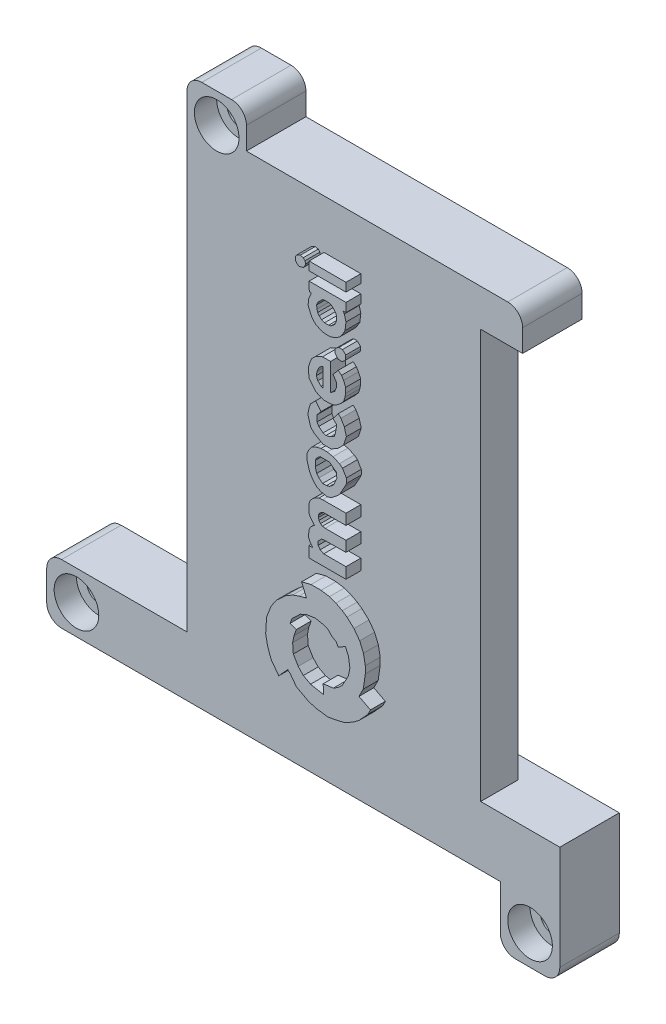
from build123d import *

# Parameters (mm, degrees)
EXTRUDE_1_DEPTH     = 8
SKETCH_2_R          = 1.6
CUT_EXTRUDE_1_DEPTH = 52.886896226
FILLET_1_R          = 2
SKETCH_3_R          = 3
CUT_EXTRUDE_2_DEPTH = 3
SKETCH_4_W          = 1.5
SKETCH_4_H          = 60
EXTRUDE_2_DEPTH     = 8
SKETCH_5_W          = 8
SKETCH_5_H          = 8
CUT_EXTRUDE_3_DEPTH = 52.886896226
SKETCH_8_W          = 5.14
SKETCH_8_H          = 8
EXTRUDE_4_DEPTH     = 8
SKETCH_9_W          = 8
SKETCH_9_H          = 8
SKETCH_9_R          = 1.6
EXTRUDE_5_DEPTH     = 8
SKETCH_10_R         = 3
CUT_EXTRUDE_5_DEPTH = 3
FILLET_3_R          = 2
SKETCH_11_W         = 3
SKETCH_11_H         = 52
CUT_EXTRUDE_6_DEPTH = 74.935782947
SKETCH_13_W         = 5.64
SKETCH_13_H         = 5
EXTRUDE_6_DEPTH     = 8
FILLET_4_R          = 2
SKETCH_14_W         = 4.955155642
SKETCH_14_H         = 1.145782211
EXTRUDE_7_DEPTH     = 2
SKETCH_16_W         = 26.241789117
SKETCH_16_H         = 17.675823019
CUT_EXTRUDE_7_DEPTH = 58.794895968
SKETCH_17_W         = 18.86
SKETCH_17_H         = 8
SKETCH_17_R         = 1.6
EXTRUDE_8_DEPTH     = 8
SKETCH_18_R         = 3
CUT_EXTRUDE_8_DEPTH = 3
FILLET_5_R          = 2


with BuildPart() as part:
    # 草图1 → 凸台-拉伸1 (new body)
    with BuildSketch(Plane.XY):
        Polygon((-17, 36.5), (-17, 23.5), (-17, -28.5), (-36, -28.5), (-36, -36.5), (36, -36.5), (36, -28.5), (23.511470082, -28.5), (21, -28.5), (21, 31.5), (-9, 31.5), (-9, 36.5), align=None)
    extrude(amount=EXTRUDE_1_DEPTH)

    # 草图2 → 切除-拉伸1 (cut, through all)
    with BuildSketch(Plane.XY.offset(8)):
        with Locations((-13, 32.5)):
            Circle(SKETCH_2_R)
        with Locations((-32, -32.5)):
            Circle(SKETCH_2_R)
        with Locations((32, -32.5)):
            Circle(SKETCH_2_R)
    extrude(amount=-CUT_EXTRUDE_1_DEPTH, mode=Mode.SUBTRACT)

    # 圆角1
    fillet_1_edges = [part.edges().sort_by_distance(p)[0] for p in [
        (-9, 36.5, 4),
        (36, -28.5, 4),
        (36, -36.5, 4),
        (-36, -36.5, 4),
        (-36, -28.5, 4),
        (-17, 36.5, 4),
    ]]
    fillet(fillet_1_edges, radius=FILLET_1_R)

    # 草图3 → 切除-拉伸2 (cut)
    with BuildSketch(Plane.XY.offset(8)):
        with Locations((-13, 32.5)):
            Circle(SKETCH_3_R)
        with Locations((-32, -32.5)):
            Circle(SKETCH_3_R)
        with Locations((32, -32.5)):
            Circle(SKETCH_3_R)
    extrude(amount=-CUT_EXTRUDE_2_DEPTH, mode=Mode.SUBTRACT)

    # 草图4 → 凸台-拉伸2 (add)
    with BuildSketch(Plane.XY.offset(8)):
        with Locations((21.75, 1.5)):
            Rectangle(SKETCH_4_W, SKETCH_4_H)
    extrude(amount=-EXTRUDE_2_DEPTH)

    # 草图5 → 切除-拉伸3 (cut, through all)
    with BuildSketch(Plane.XY.offset(8)):
        with Locations((32, -32.5)):
            Rectangle(SKETCH_5_W, SKETCH_5_H)
    extrude(amount=-CUT_EXTRUDE_3_DEPTH, mode=Mode.SUBTRACT)

    # 草图8 → 凸台-拉伸4 (add)
    with BuildSketch(Plane.XY.offset(8)):
        with Locations((30.57, -32.5)):
            Rectangle(SKETCH_8_W, SKETCH_8_H)
    extrude(amount=-EXTRUDE_4_DEPTH)

    # 草图9 → 凸台-拉伸5 (add)
    with BuildSketch(Plane.XY.offset(8)):
        with Locations((29.14, -40.5)):
            Rectangle(SKETCH_9_W, SKETCH_9_H)
        with Locations((29.14, -40.5)):
            Circle(SKETCH_9_R, mode=Mode.SUBTRACT)
    extrude(amount=-EXTRUDE_5_DEPTH)

    # 草图10 → 切除-拉伸5 (cut)
    with BuildSketch(Plane.XY.offset(8)):
        with Locations((29.14, -40.5)):
            Circle(SKETCH_10_R)
    extrude(amount=-CUT_EXTRUDE_5_DEPTH, mode=Mode.SUBTRACT)

    # 圆角3
    fillet_3_edges = [part.edges().sort_by_distance(p)[0] for p in [
        (25.14, -44.5, 4),
        (33.14, -44.5, 4),
    ]]
    fillet(fillet_3_edges, radius=FILLET_3_R)

    # 草图11 → 切除-拉伸6 (cut, through all)
    with BuildSketch(Plane(origin=(22.5, 0, 0), x_dir=(0, 0, -1), z_dir=(1, 0, 0))):
        with Locations((-1.5, -2.5)):
            Rectangle(SKETCH_11_W, SKETCH_11_H)
    extrude(amount=-CUT_EXTRUDE_6_DEPTH, mode=Mode.SUBTRACT)

    # 草图13 → 凸台-拉伸6 (add)
    with BuildSketch(Plane.XY.offset(8)):
        with Locations((25.32, 29)):
            Rectangle(SKETCH_13_W, SKETCH_13_H)
    extrude(amount=-EXTRUDE_6_DEPTH)

    # 圆角4
    fillet_4_edges = [part.edges().sort_by_distance(p)[0] for p in [
        (28.14, 31.5, 4),
    ]]
    fillet(fillet_4_edges, radius=FILLET_4_R)

    # 草图14 → 凸台-拉伸7 (add)
    # profile 1 of 9: a face of its own
    with BuildSketch(Plane.XY.offset(8)):
        Polygon((1.402065016, -9.679325293), (6.381663226, -9.679325293), (6.381663226, -8.211654242), (3.3939043, -8.211654242), (2.92215289, -7.9670424), (2.6425965, -7.600124637), (2.6425965, -7.093428679), (2.887191339, -6.84883384), (3.094574912, -6.641450266), (3.341420542, -6.573802125), (6.381663226, -6.54645484), (6.381663226, -5.138069694), (3.58298822, -5.138069694), (3.217997727, -5.083375125), (2.954000679, -4.910175657), (2.764893919, -4.632144932), (2.681682685, -4.328510139), (2.681682685, -4.085199244), (2.812706376, -3.788936997), (3.033783665, -3.567859708), (3.313009633, -3.415314641), (3.755940298, -3.415314641), (6.381663226, -3.415314641), (6.381663226, -1.982352914), (3.249028314, -1.982352914), (2.747194531, -2.037528592), (2.255866113, -2.254552925), (1.957224854, -2.491300898), (1.694085702, -2.75444005), (1.522836734, -3.015464074), (1.402065016, -3.384406137), (1.402065016, -4.431723867), (1.572952789, -4.818602233), (1.804531171, -5.110722409), (2.037845875, -5.405032835), (2.12941328, -5.52053881), (1.804531171, -5.778089227), (1.572952789, -6.077808365), (1.435759026, -6.388021979), (1.36670543, -6.84883384), (1.36670543, -7.329589901), (1.478092254, -7.581762141), (1.622033042, -7.845238416), (1.804531171, -8.075447234), (1.966972226, -8.237888288), (1.422398842, -8.237888288), align=None)
    # profile 2 of 9: a face of its own
    with BuildSketch(Plane.XY.offset(8)):
        Polygon((1.17487881, 1.827946024), (1.17487881, 2.391717474), (1.402065016, 2.905416144), (1.825655278, 3.453645678), (2.448301575, 3.728674339), (3.033783665, 3.889125935), (3.852649284, 3.889125935), (4.645351253, 3.728674339), (5.086706401, 3.533482474), (5.501489329, 3.350042327), (5.92143789, 3.025568525), (6.190678633, 2.576396696), (6.440905615, 2.158945346), (6.440905615, 1.496946701), (6.26067092, 1.089411733), (5.781443798, 0.23732149), (5.537099721, -0.197134731), (5.159491903, -0.574742549), (4.408087428, -1.170418736), (3.852649284, -1.322636777), (3.060170459, -1.162230348), (2.501530322, -0.915168519), (1.957224854, -0.370863051), (1.522836734, 0.353822615), (1.288471913, 1.089411733), (1.138555945, 1.636449697), align=None)
        Polygon((2.747194531, 2.761075917), (2.377836088, 2.391717474), (2.255866113, 2.115926899), (2.255866113, 1.383152458), (2.448301575, 0.680962392), (2.747194531, 0.303929518), (3.249028314, -0.083813007), (3.755940298, -0.083813007), (4.170823602, 0.029885925), (4.694154951, 0.444757054), (4.953891934, 1.032057425), (5.159491903, 1.496946701), (5.086706401, 2.158945346), (4.645351253, 2.499958975), (4.170823602, 2.866603382), (3.534474966, 2.866603382), (2.923245021, 2.866603382), align=None, mode=Mode.SUBTRACT)
    # profile 3 of 9: a face of its own
    with BuildSketch(Plane.XY.offset(8)):
        Polygon((3.033783665, 8.175824675), (2.3168511, 9.080185717), (1.613860147, 8.377194763), (1.402065016, 7.730187882), (1.262459559, 6.994179536), (1.469379975, 6.239134397), (1.658640461, 5.645111993), (2.136978427, 5.166774027), (3.313009633, 4.505358109), (4.408087428, 4.505358109), (5.348295812, 5.068933977), (6.056058262, 5.776696427), (6.268562751, 6.425870305), (6.440905615, 6.952355586), (6.162310506, 7.968939097), (5.702177037, 8.736575489), (5.348295812, 9.090456714), (4.641604177, 8.175824675), (5.087240971, 7.730187882), (5.087240971, 7.324525309), (4.952973087, 6.616656967), (4.811388458, 6.18413414), (4.314996986, 5.886589192), (3.683836391, 5.713619384), (3.313009633, 5.835008049), (2.72499403, 6.28933907), (2.483240902, 6.692653568), (2.483240902, 7.527356595), align=None)
    # profile 4 of 9: a face of its own
    with BuildSketch(Plane.XY.offset(8)):
        Polygon((4.641604177, 13.309933667), (5.348295812, 14.142324896), (5.781443798, 13.774586689), (6.056058262, 13.316449931), (6.348328701, 12.654769414), (6.348328701, 11.984831779), (6.248972889, 11.461021976), (6.056058262, 10.871692604), (5.702177037, 10.454866349), (4.994949995, 9.894211839), (4.314996986, 9.707870451), (3.313009633, 9.707870451), (2.3168511, 10.148427319), (1.850607691, 10.736561261), (1.426507584, 11.271534331), (1.348081875, 11.984831779), (1.348081875, 12.568272163), (1.552333513, 13.192234644), (1.788451502, 13.726129282), (2.3168511, 14.25452888), (2.675317383, 14.412866772), (3.228859993, 14.657371692), (3.860548531, 14.657371692), (4.314996986, 14.657371692), (4.314996986, 11.004047796), (4.864422574, 11.439605143), (5.087240971, 11.943427607), (5.087240971, 12.654769414), align=None)
        Polygon((3.313009633, 13.54551831), (3.313009633, 11.004047796), (3.033783665, 11.127537095), (2.604117466, 11.557203294), (2.39216164, 12.037056956), (2.498139553, 12.595778875), (2.736685409, 13.135163248), (3.033783665, 13.432261504), align=None, mode=Mode.SUBTRACT)
    # profile 5 of 9: a face of its own
    with BuildSketch(Plane.XY.offset(8)):
        Polygon((5.65927176, 16.851418456), (5.91875103, 16.851418456), (6.087418243, 16.682751242), (6.348328701, 16.421840784), (6.348328701, 16.091106805), (6.290640818, 15.78697282), (6.087418243, 15.583750246), (5.836028894, 15.412757486), (5.348295812, 15.419637759), (5.123099152, 15.644834419), (4.922983307, 15.939039812), (4.922983307, 16.421840784), (5.167315538, 16.666173015), (5.439658829, 16.851418456), align=None)
    # profile 6 of 9: a face of its own
    with BuildSketch(Plane.XY.offset(8)):
        Polygon((1.426507584, 22.566743875), (6.381663226, 22.566743875), (6.381663226, 21.376024691), (6.000604884, 21.376024691), (6.162310506, 21.105961801), (6.248972889, 20.778816281), (6.381663226, 20.27791788), (6.315318058, 19.716273962), (6.255621711, 19.210915537), (6.000604884, 18.743432822), (5.59903531, 18.184397655), (5.167315538, 17.856267351), (4.783789665, 17.695259239), (4.346998253, 17.511889706), (3.58298822, 17.511889706), (3.112082847, 17.603574472), (2.3168511, 17.971273144), (1.788451502, 18.523300955), (1.593379114, 18.987968898), (1.299149537, 19.688832066), (1.348081875, 20.449648001), (1.552333513, 20.924497818), (1.734741569, 21.348565076), (1.450207694, 21.348565076), align=None)
        Polygon((2.675317383, 20.778816281), (3.054241856, 21.157740754), (3.294953592, 21.348565076), (3.544704262, 21.376024691), (3.927400997, 21.376024691), (4.22539543, 21.376024691), (4.536115916, 21.172171567), (4.783789665, 20.924497818), (4.994949995, 20.658133609), (5.102577159, 20.39278709), (5.138567236, 20.065450166), (5.086242471, 19.716273962), (4.88936983, 19.271118353), (4.606220376, 18.987968898), (4.380755673, 18.834609849), (4.048053989, 18.743432822), (3.498423012, 18.751186266), (3.112082847, 18.922047437), (2.771833633, 19.210915537), (2.579488816, 19.493696157), (2.483240902, 19.844901325), (2.434059322, 20.292217597), (2.56251531, 20.582673921), align=None, mode=Mode.SUBTRACT)
    # profile 7 of 9: a face of its own
    with BuildSketch(Plane.XY.offset(8)):
        Polygon((0.239057895, 24.990082687), (0.65101973, 24.909874163), (0.87778222, 24.672971635), (0.967593759, 24.333938235), (0.829140592, 24.012058512), (0.65101973, 23.764091952), (0.415805615, 23.701782629), (0.068553901, 23.609794021), (-0.146248154, 23.764091952), (-0.434228892, 24.064950197), (-0.434228892, 24.503454935), (-0.227373976, 24.791422899), (0.003836638, 24.888487496), align=None)
    # profile 8 of 9: a face of its own
    with BuildSketch(Plane.XY.offset(8)):
        with Locations((3.904085405, 24.336983057)):
            Rectangle(SKETCH_14_W, SKETCH_14_H)
    # profile 9 of 9: a face of its own
    with BuildSketch(Plane.XY.offset(8)):
        Polygon((1.073540166, -14.519810043), (0.415805615, -12.959668722), (1.694085702, -12.635483512), (3.033783665, -12.635483512), (4.170823602, -12.797576117), (5.021225382, -13.131892114), (5.887867903, -13.577646778), (6.513773217, -14.013270653), (7.455936482, -14.874387617), (8.225876355, -15.91785876), (8.732730263, -17.120112351), (8.985685441, -18.440424923), (8.985685441, -19.395475216), (8.876745929, -20.159659221), (8.712801164, -21.309691602), (8.129403131, -22.443942311), (9.679907502, -23.241439014), (9.312020678, -23.95668978), (8.774196312, -24.54513291), (8.129403131, -25.250612508), (7.382799301, -25.801504655), (6.28203912, -26.433815722), (5.348295812, -26.670622798), (3.953811474, -26.937788347), (2.448301575, -26.723167898), (1.402065016, -26.433815722), (-0.290238523, -25.526058581), (-1.091543439, -24.440079551), (-1.446489223, -24.115666737), (-2.655241802, -25.438184264), (-3.686599357, -24.040423367), (-4.168620921, -22.683907473), (-4.413933349, -21.403486622), (-4.291277135, -19.395475216), (-3.664968923, -17.802330941), (-2.934740551, -16.753137258), (-2.165472016, -16.052203589), (-1.695214733, -15.623719713), (-0.785363167, -15.101072524), (0.068553901, -14.797643392), align=None)
        Polygon((-1.131374218, -18.563368174), (-0.290238523, -18.868165783), (-0.612859218, -19.758487012), (-0.785363167, -20.644490646), (-0.699111192, -21.926092275), (-0.038847127, -23.028792471), (0.65101973, -23.7495078), (1.622033042, -24.279205962), (2.448301575, -24.440079551), (3.3939043, -24.624187379), (3.310786115, -23.389150136), (4.694154951, -23.191441169), (5.348295812, -22.799761086), (5.887867903, -22.28328407), (6.28203912, -21.560711242), (6.705720037, -20.784042866), (6.905394652, -19.758487012), (6.72648223, -18.506637528), (6.309480311, -17.541161556), (5.348295812, -18.116690233), (5.021225382, -17.570453285), (4.515885535, -17.294784986), (3.953811474, -16.707576907), (3.310786115, -16.474567426), (2.255866113, -16.269175643), (1.136526386, -16.429149972), (0.242179758, -16.815430181), (-0.290238523, -17.325059588), (-0.891048951, -17.900153783), align=None, mode=Mode.SUBTRACT)
    extrude(amount=EXTRUDE_7_DEPTH)

    # 草图16 → 切除-拉伸7 (cut, through all)
    with BuildSketch(Plane.XY.offset(8)):
        with Locations((-30.120894559, -37.33791151)):
            Rectangle(SKETCH_16_W, SKETCH_16_H)
    extrude(amount=-CUT_EXTRUDE_7_DEPTH, mode=Mode.SUBTRACT)

    # 草图17 → 凸台-拉伸8 (add)
    with BuildSketch(Plane.XY.offset(8)):
        with Locations((-26.43, -32.5)):
            Rectangle(SKETCH_17_W, SKETCH_17_H)
        with Locations((-31.86, -32.5)):
            Circle(SKETCH_17_R, mode=Mode.SUBTRACT)
    extrude(amount=-EXTRUDE_8_DEPTH)

    # 草图18 → 切除-拉伸8 (cut)
    with BuildSketch(Plane.XY.offset(8)):
        with Locations((-31.86, -32.5)):
            Circle(SKETCH_18_R)
    extrude(amount=-CUT_EXTRUDE_8_DEPTH, mode=Mode.SUBTRACT)

    # 圆角5
    fillet_5_edges = [part.edges().sort_by_distance(p)[0] for p in [
        (-35.86, -28.5, 4),
        (-35.86, -36.5, 4),
    ]]
    fillet(fillet_5_edges, radius=FILLET_5_R)


solid = part.part
